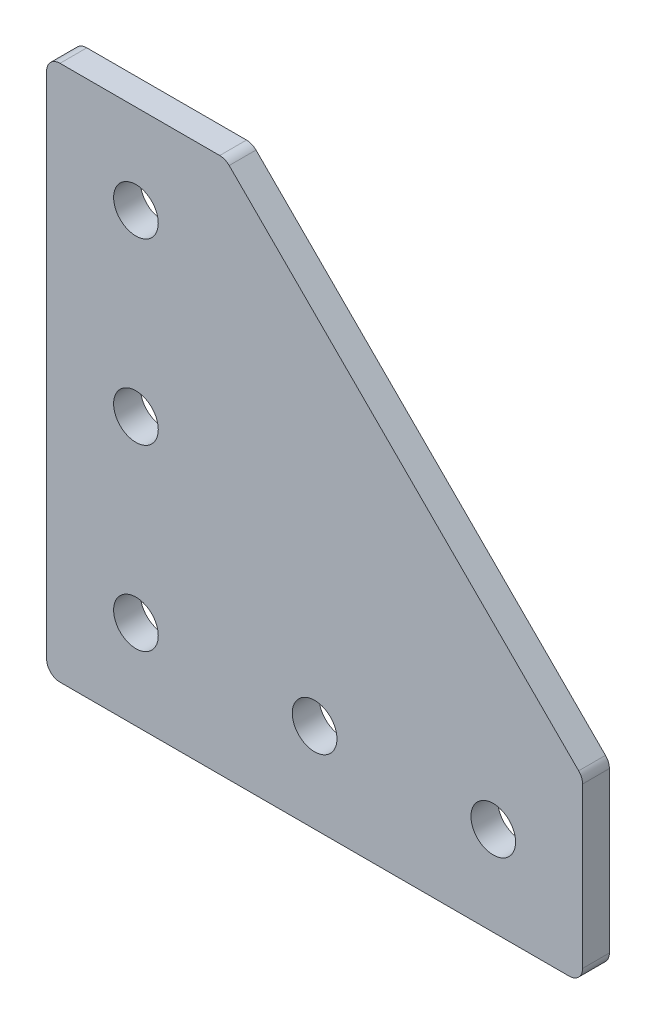
from build123d import *

# Parameters (mm, degrees)
BOSS_EXTRUDE1_DEPTH = 3
SKETCH2_R           = 2.5
CUT_EXTRUDE1_DEPTH  = 3


with BuildPart() as part:
    # Sketch1 → Boss-Extrude1 (new body)
    with BuildSketch(Plane.XY):
        with BuildLine():
            Line((1.5, 60), (19.378679656, 60))
            ThreePointArc((19.378679656, 60), (19.952704805, 59.885819299), (20.439339828, 59.560660172))
            Line((20.439339828, 59.560660172), (59.560660172, 20.439339828))
            ThreePointArc((59.560660172, 20.439339828), (59.885819299, 19.952704805), (60, 19.378679656))
            Line((60, 19.378679656), (60, 1.5))
            ThreePointArc((60, 1.5), (59.560660172, 0.439339828), (58.5, 0))
            Line((58.5, 0), (1.5, 0))
            ThreePointArc((1.5, 0), (0.439339828, 0.439339828), (0, 1.5))
            Line((0, 1.5), (0, 58.5))
            ThreePointArc((0, 58.5), (0.439339828, 59.560660172), (1.5, 60))
        make_face()
    extrude(amount=-BOSS_EXTRUDE1_DEPTH)

    # Sketch2 → Cut-Extrude1 (cut)
    with BuildSketch(Plane.XY):
        with Locations((10, 10)):
            Circle(SKETCH2_R)
        with Locations((30, 10)):
            Circle(SKETCH2_R)
        with Locations((50, 10)):
            Circle(SKETCH2_R)
        with Locations((10, 30)):
            Circle(SKETCH2_R)
        with Locations((10, 50)):
            Circle(SKETCH2_R)
    extrude(amount=-CUT_EXTRUDE1_DEPTH, mode=Mode.SUBTRACT)


solid = part.part
